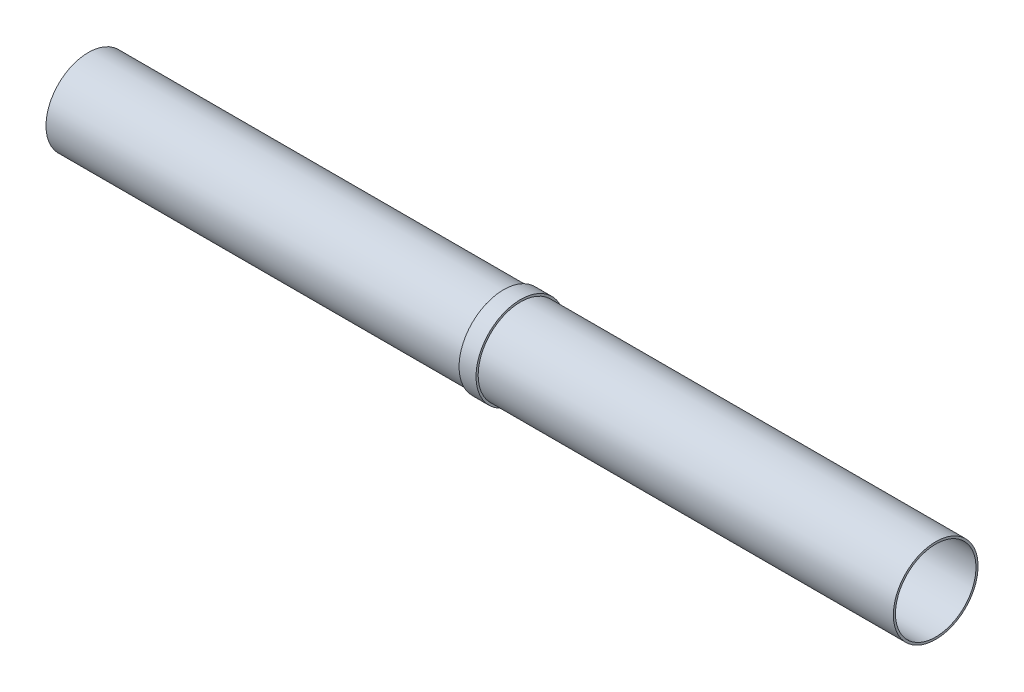
from build123d import *

# Parameters (mm, degrees)
SKETCH1_R           = 63.5
SKETCH1_R_2         = 60.325
BOSS_EXTRUDE1_DEPTH = 635
SKETCH3_R           = 66.675
BOSS_EXTRUDE3_DEPTH = 12.7
SKETCH13_R          = 60.325
CUT_EXTRUDE2_DEPTH  = 72.39


with BuildPart() as part:
    # Sketch1 → Boss-Extrude1 (new, symmetric)
    with BuildSketch(Plane(origin=(0, 0, 0), x_dir=(0, 0, -1), z_dir=(1, 0, 0))):
        with Locations(Location((0, 0, 0), (0, 0, 180))):
            Circle(SKETCH1_R)
        with Locations(Location((0, 0, 0), (0, 0, 180))):
            Circle(SKETCH1_R_2, mode=Mode.SUBTRACT)
    extrude(amount=BOSS_EXTRUDE1_DEPTH, both=True)

    # Sketch3 → Boss-Extrude3 (add, symmetric)
    with BuildSketch(Plane(origin=(0, 0, 0), x_dir=(0, 0, -1), z_dir=(1, 0, 0))):
        Circle(SKETCH3_R)
    extrude(amount=BOSS_EXTRUDE3_DEPTH, both=True)

    # Sketch13 → Cut-Extrude2 (cut, symmetric)
    with BuildSketch(Plane.ZY.offset(12.7)):
        Circle(SKETCH13_R)
    extrude(amount=CUT_EXTRUDE2_DEPTH, both=True, mode=Mode.SUBTRACT)


solid = part.part
